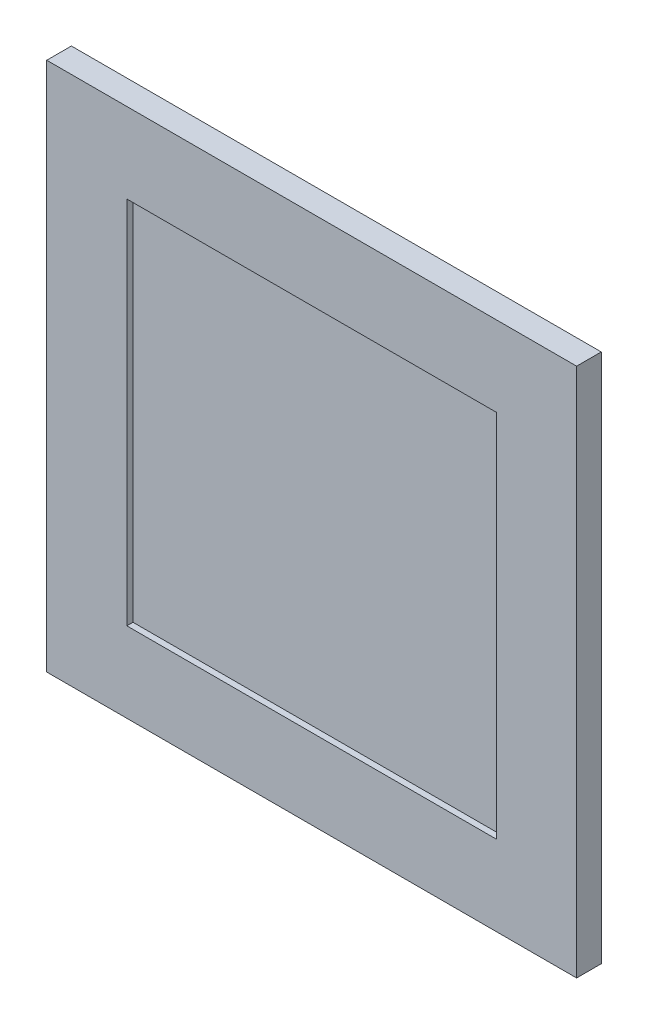
from build123d import *

# Parameters (mm, degrees)
SKETCH_2_W          = 430
SKETCH_2_H          = 430
EXTRUDE_1_DEPTH     = 20
SKETCH_3_W          = 300
SKETCH_3_H          = 300
CUT_EXTRUDE_1_DEPTH = 5


with BuildPart() as part:
    # 스케치2 → 보스-돌출1 (new body)
    with BuildSketch(Plane.XY):
        Rectangle(SKETCH_2_W, SKETCH_2_H)
    extrude(amount=EXTRUDE_1_DEPTH)

    # 스케치3 → 컷-돌출1 (cut)
    with BuildSketch(Plane.XY.offset(20)):
        Rectangle(SKETCH_3_W, SKETCH_3_H)
    extrude(amount=-CUT_EXTRUDE_1_DEPTH, mode=Mode.SUBTRACT)


solid = part.part
